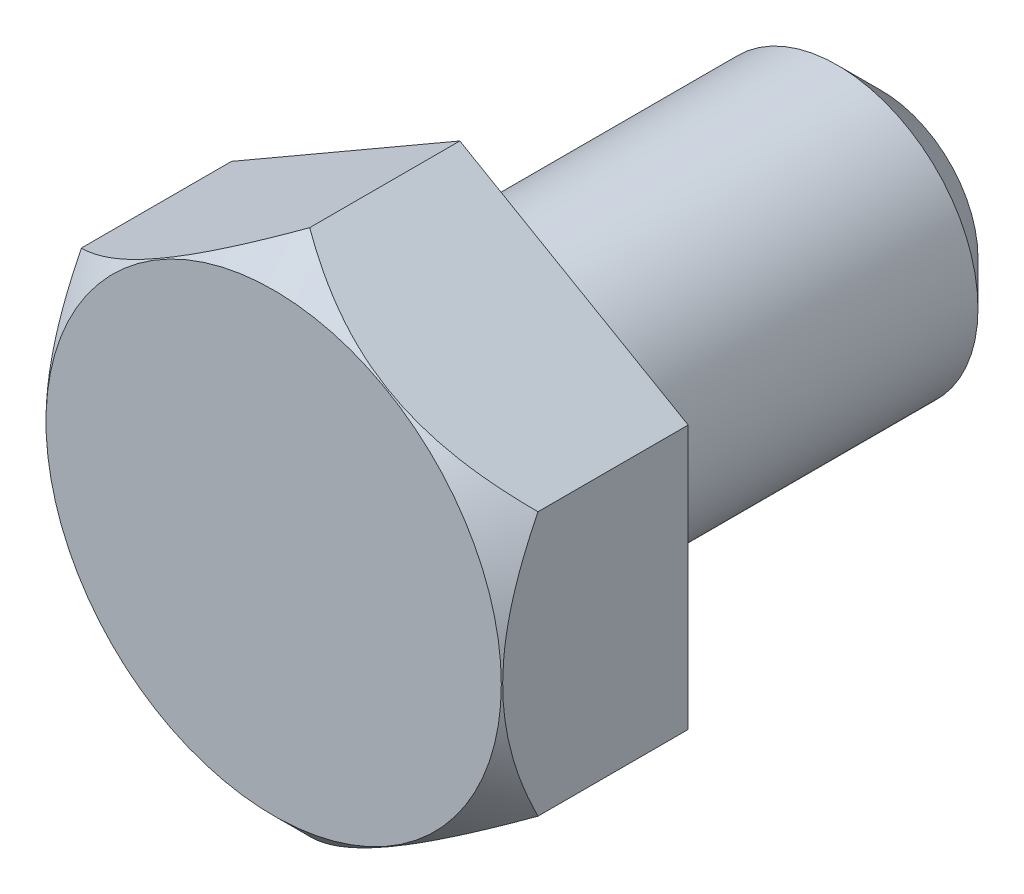
from build123d import *

# Parameters (mm, degrees)
EXTRUDE_1_DEPTH = 5.3
SKETCH_2_R      = 4
EXTRUDE_2_DEPTH = 12
CHAMFER_1_SIZE  = 1.25


with BuildPart() as part:
    # Эскиз1 → Вытянуть1 (new body)
    with BuildSketch(Plane.XY):
        Polygon((0, 7.505553499), (-6.5, 3.75277675), (-6.5, -3.75277675), (0, -7.505553499), (6.5, -3.75277675), (6.5, 3.75277675), align=None)
    extrude(amount=EXTRUDE_1_DEPTH)

    # Эскиз2 → Вытянуть2 (add)
    with BuildSketch(Plane(origin=(0, 0, 0), x_dir=(-1, 0, 0), z_dir=(0, 0, -1))):
        with Locations(Location((0, 0, 0), (0, 0, 180))):
            Circle(SKETCH_2_R)
    extrude(amount=EXTRUDE_2_DEPTH)

    # Эскиз15 → Вырез-Повернуть1 (revolve, cut)
    with BuildSketch(Plane(origin=(0, 0, 0), x_dir=(0, 0, -1), z_dir=(1, 0, 0)), mode=Mode.PRIVATE) as cut_revolve_1_sk:
        Polygon((-5.3, 7.505553499), (-5.3, 6.480553499), (-4.275, 7.505553499), align=None)
    revolve(cut_revolve_1_sk.sketch.rotate(Axis((0, 0, 0.465296569), (0, 0, -1)), 300.000000073), axis=Axis((0, 0, 0.465296569), (0, 0, -1)), mode=Mode.SUBTRACT)

    # Фаска1
    chamfer_1_edges = [part.edges().sort_by_distance(p)[0] for p in [
        (-4, 0, -12),
    ]]
    chamfer(chamfer_1_edges, length=CHAMFER_1_SIZE)


solid = part.part
